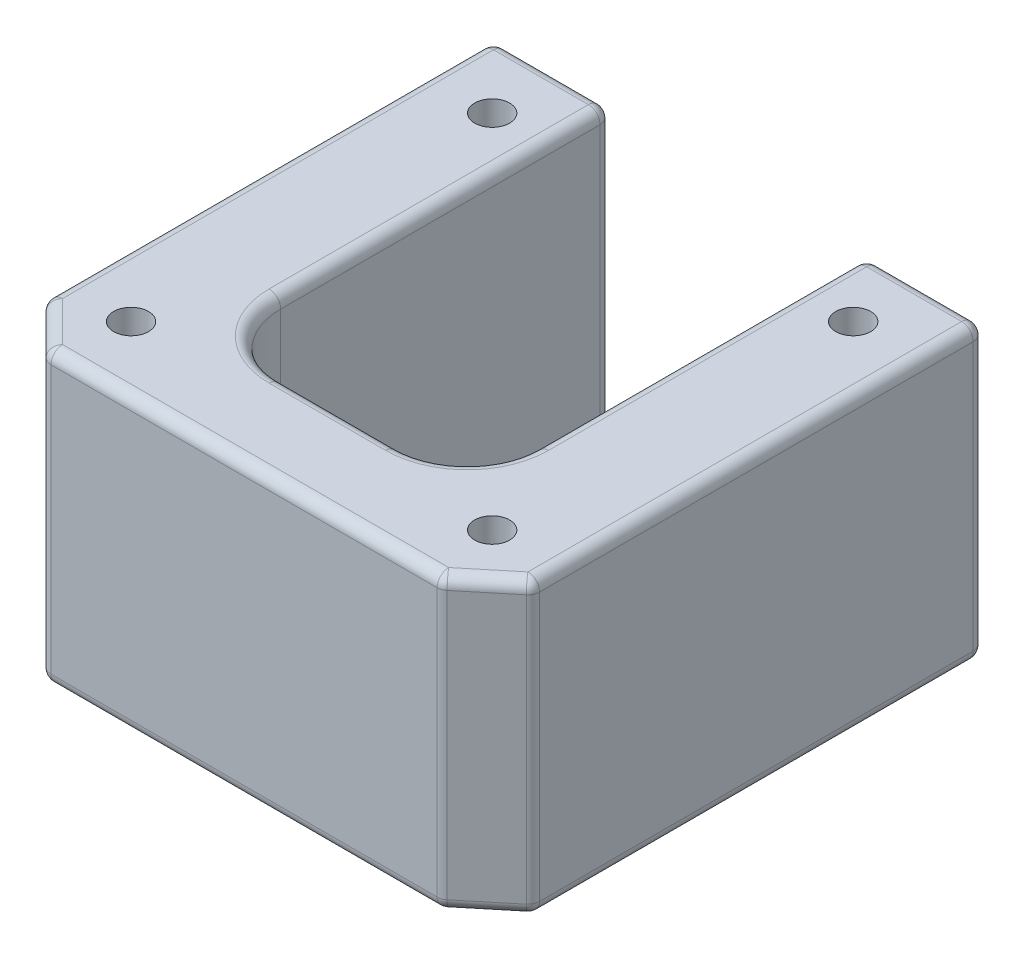
from build123d import *

# Parameters (mm, degrees)
BOSS_EXTRUDE1_DEPTH = 25
SKETCH2_R           = 1.5
CUT_EXTRUDE1_DEPTH  = 51.046074471
FILLET1_R           = 6
CUT_EXTRUDE2_DEPTH  = 51.046074471
FILLET2_R           = 1


with BuildPart() as part:
    # Sketch1 → Boss-Extrude1 (new body)
    with BuildSketch(Plane(origin=(0, 0, 0), x_dir=(1, 0, 0), z_dir=(0, 1, 0))):
        Polygon((-10.255294708, 3.008405172), (11.744705292, 3.008405172), (11.744705292, 37.308405172), (21.894705292, 37.308405172), (21.894705292, 2.897143722), (21.894705292, -4.991594828), (-20.405294708, -4.991594828), (-20.405294708, 3.008405172), (-20.405294708, 37.419666622), (-10.255294708, 37.419666622), align=None)
    extrude(amount=BOSS_EXTRUDE1_DEPTH)

    # Sketch2 → Cut-Extrude1 (cut, through all)
    with BuildSketch(Plane.XZ):
        with Locations(Location((-14.755294708, -31.658405172, 0), (0, 0, 270))):
            Circle(SKETCH2_R)
        with Locations(Location((-14.755294708, -0.658405172, 0), (0, 0, 270))):
            Circle(SKETCH2_R)
        with Locations(Location((16.244705292, -0.658405172, 0), (0, 0, 270))):
            Circle(SKETCH2_R)
        with Locations(Location((16.244705292, -31.658405172, 0), (0, 0, 270))):
            Circle(SKETCH2_R)
    extrude(amount=-CUT_EXTRUDE1_DEPTH, mode=Mode.SUBTRACT)

    # Fillet1
    fillet1_edges = [part.edges().sort_by_distance(p)[0] for p in [
        (-10.255294708, 12.5, -3.008405172),
        (11.744705292, 12.5, -3.008405172),
    ]]
    fillet(fillet1_edges, radius=FILLET1_R)

    # Sketch3 → Cut-Extrude2 (cut, through all)
    with BuildSketch(Plane.XZ):
        Polygon((21.894705292, 1.391259285), (17.527419638, 4.991594828), (21.894705292, 4.991594828), align=None)
        Polygon((-20.405294708, 0.994660971), (-16.397786785, 4.991594828), (-20.405294708, 4.991594828), align=None)
    extrude(amount=-CUT_EXTRUDE2_DEPTH, mode=Mode.SUBTRACT)

    # Fillet2
    fillet2_edges = [part.edges().sort_by_distance(p)[0] for p in [
        (16.819705292, 25, -37.308405172),
        (-15.330294708, 0, -37.419666622),
        (11.744705292, 0, -23.158405172),
        (16.819705292, 0, -37.308405172),
        (11.744705292, 25, -23.158405172),
        (-20.405294708, 12.5, -37.419666622),
        (-10.255294708, 12.5, -37.419666622),
        (11.744705292, 12.5, -37.308405172),
        (21.894705292, 12.5, -37.308405172),
        (-15.330294708, 25, -37.419666622),
        (-20.405294708, 25, -18.212502825),
        (-10.255294708, 0, -23.214035897),
        (-10.255294708, 25, -23.214035897),
        (0.744705292, 0, -3.008405172),
        (0.744705292, 25, -3.008405172),
        (-8.497935395, 0, -4.765764485),
        (-8.497935395, 25, -4.765764485),
        (9.98734598, 0, -4.765764485),
        (9.98734598, 25, -4.765764485),
        (21.894705292, 0, -17.958572944),
        (21.894705292, 25, -17.958572944),
        (19.711062465, 25, 3.191427056),
        (21.894705292, 12.5, 1.391259285),
        (17.527419638, 12.5, 4.991594828),
        (19.711062465, 0, 3.191427056),
        (0.564816427, 0, 4.991594828),
        (0.564816427, 25, 4.991594828),
        (-20.405294708, 12.5, 0.994660971),
        (-18.401540746, 25, 2.993127899),
        (-16.397786785, 12.5, 4.991594828),
        (-18.401540746, 0, 2.993127899),
        (-20.405294708, 0, -18.212502825),
    ]]
    fillet(fillet2_edges, radius=FILLET2_R)


solid = part.part
